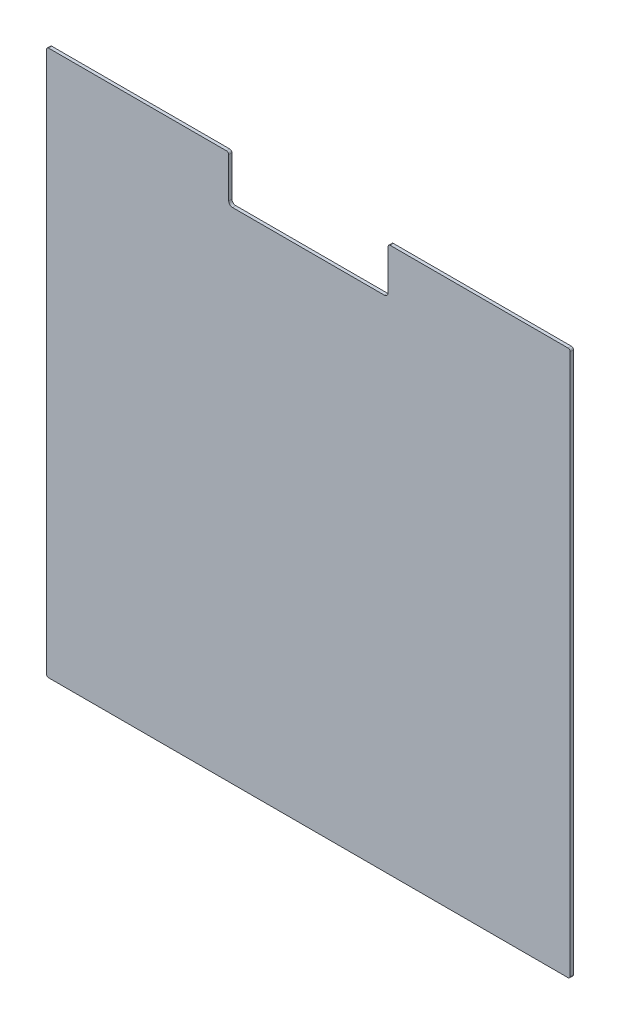
from build123d import *

# Parameters (mm, degrees)
BOSS_EXTRUDE1_DEPTH = 3


with BuildPart() as part:
    # Model → Boss-Extrude1 (new body)
    with BuildSketch(Plane.XY):
        with BuildLine():
            Line((76.477385891, -141.499999434), (-402.52261402, -141.499999434))
            ThreePointArc((-402.52261402, -141.499999434), (-403.936827582, -140.914212996), (-404.52261402, -139.499999434))
            Line((-404.52261402, -139.499999434), (-404.52261402, 359.500000477))
            ThreePointArc((-404.52261402, 359.500000477), (-403.936827582, 360.914214039), (-402.52261402, 361.500000477))
            Line((-402.52261402, 361.500000477), (-238.499667694, 361.500000477))
            ThreePointArc((-238.499667694, 361.500000477), (-237.085454131, 360.914214039), (-236.499667694, 359.500000477))
            Line((-236.499667694, 359.500000477), (-236.499667694, 322.5))
            ThreePointArc((-236.499667694, 322.5), (-235.474541428, 320.025126266), (-232.999667694, 319))
            Line((-232.999667694, 319), (-92.999667694, 319))
            ThreePointArc((-92.999667694, 319), (-90.524793959, 320.025126266), (-89.499667694, 322.5))
            Line((-89.499667694, 322.5), (-89.499667694, 359.500000477))
            ThreePointArc((-89.499667694, 359.500000477), (-88.913881256, 360.914214039), (-87.499667694, 361.500000477))
            Line((-87.499667694, 361.500000477), (76.477385891, 361.500000477))
            ThreePointArc((76.477385891, 361.500000477), (77.891599453, 360.914214039), (78.477385891, 359.500000477))
            Line((78.477385891, 359.500000477), (78.477385891, -139.499999434))
            ThreePointArc((78.477385891, -139.499999434), (77.891599453, -140.914212996), (76.477385891, -141.499999434))
        make_face()
    extrude(amount=BOSS_EXTRUDE1_DEPTH)


solid = part.part
